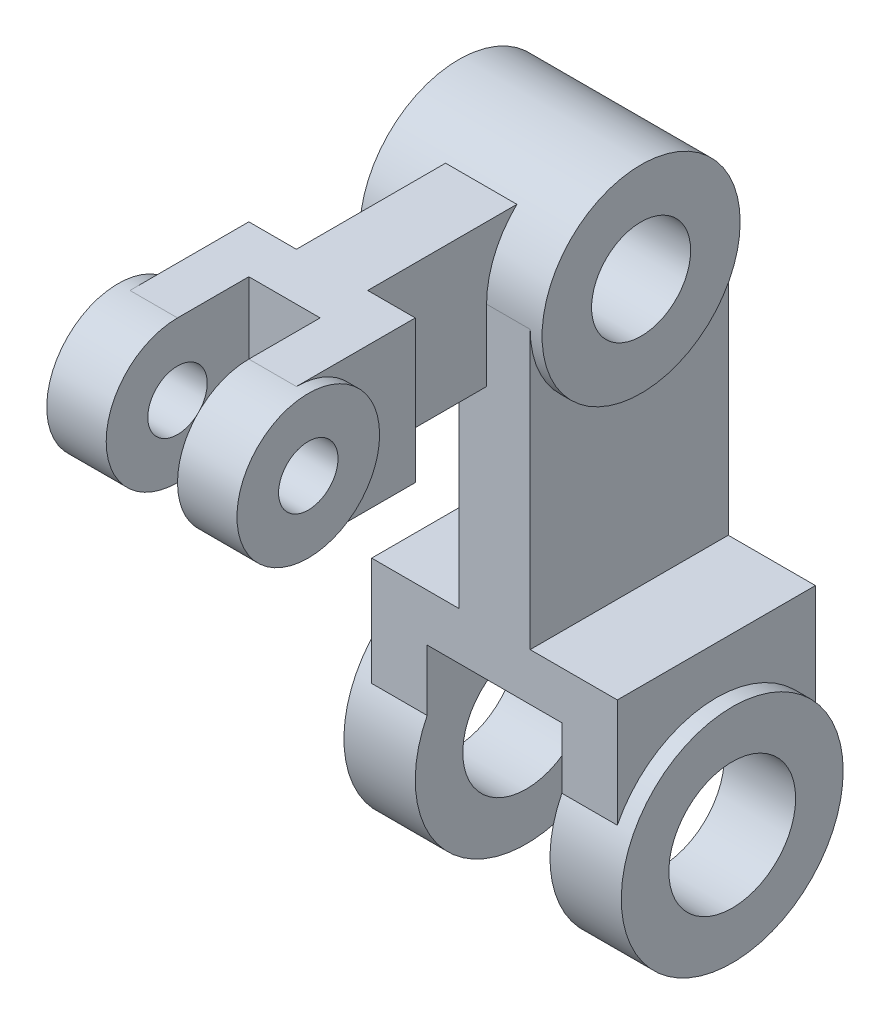
from build123d import *

# Parameters (mm, degrees)
SKETCH1_R               = 25
SKETCH1_R_2             = 12.5
BOSS_EXTRUDE1_DEPTH     = 23
BOSS_EXTRUDE3_START     = 20
BOSS_EXTRUDE3_DEPTH     = 18
SKETCH5_R               = 16
BOSS_EXTRUDE4_DEPTH     = 35
BOSS_EXTRUDE5_DEPTH     = 31
CUT_EXTRUDE2_DEPTH      = 155.819249449
CUT_EXTRUDE2_DEPTH_BACK = 155.819249449
SKETCH6_W               = 34
SKETCH6_H               = 70
SKETCH8_R               = 18
SKETCH8_R_2             = 7.5
BOSS_EXTRUDE6_DEPTH     = 24
BOSS_EXTRUDE7_DEPTH     = 21
BOSS_EXTRUDE8_DEPTH     = 9
CUT_EXTRUDE4_DEPTH      = 193.512337267
CUT_EXTRUDE4_DEPTH_BACK = 193.512337267
SKETCH10_W              = 18
SKETCH10_H              = 50


with BuildPart() as part:
    # Sketch1 → Boss-Extrude1 (new, symmetric)
    with BuildSketch(Plane(origin=(0, 0, 0), x_dir=(0, 0, -1), z_dir=(1, 0, 0))):
        Circle(SKETCH1_R)
        Circle(SKETCH1_R_2, mode=Mode.SUBTRACT)
    extrude(amount=BOSS_EXTRUDE1_DEPTH, both=True)

    # Sketch4 → Boss-Extrude3 (add)
    with BuildSketch(Plane(origin=(0, 0, 0), x_dir=(0, 0, -1), z_dir=(1, 0, 0)).offset(BOSS_EXTRUDE3_START)):
        with BuildLine():
            Line((-25, 0), (-25, -70))
            Line((-25, -70), (25, -70))
            Line((25, -70), (25, 0))
            ThreePointArc((25, 0), (0, -25), (-25, 0))
        make_face()
    extrude(amount=-BOSS_EXTRUDE3_DEPTH)



with BuildPart() as body_2:
    # Sketch5 → Boss-Extrude4 (new, symmetric)
    with BuildSketch(Plane(origin=(11, 0, 0), x_dir=(0, 0, -1), z_dir=(1, 0, 0))):
        with BuildLine():
            ThreePointArc((25, -97.390479787), (0, -82), (-25, -97.390479787))
            ThreePointArc((-25, -97.390479787), (-6.480740698, -137.239676944), (28, -110))
            ThreePointArc((28, -110), (27.239676944, -103.519259302), (25, -97.390479787))
        make_face()
        with Locations((0, -110)):
            Circle(SKETCH5_R, mode=Mode.SUBTRACT)
    extrude(amount=BOSS_EXTRUDE4_DEPTH, both=True)


with BuildPart() as part_1:
    add(part.part)

    add(body_2.part)  # Boss-Extrude5 merges body 2
    # Sketch5<4> → Boss-Extrude5 (add, symmetric)
    with BuildSketch(Plane(origin=(11, 0, 0), x_dir=(0, 0, -1), z_dir=(1, 0, 0))):
        with BuildLine():
            Line((-25, -70), (-25, -97.390479787))
            ThreePointArc((-25, -97.390479787), (0, -82), (25, -97.390479787))
            Line((25, -97.390479787), (25, -70))
            Line((25, -70), (-25, -70))
        make_face()
    extrude(amount=BOSS_EXTRUDE5_DEPTH, both=True)

    # Sketch6 → Cut-Extrude2 (cut, two sides: drawn at the far end of the back side and taken through both)
    with BuildSketch(Plane.XY.offset(25).offset(-CUT_EXTRUDE2_DEPTH_BACK)):
        with Locations((11, -117)):
            Rectangle(SKETCH6_W, SKETCH6_H)
    extrude(amount=CUT_EXTRUDE2_DEPTH + CUT_EXTRUDE2_DEPTH_BACK, mode=Mode.SUBTRACT)



with BuildPart() as body_2_2:
    # Sketch8 → Boss-Extrude6 (new, symmetric)
    with BuildSketch(Plane(origin=(0, 0, 0), x_dir=(0, 0, -1), z_dir=(1, 0, 0))):
        with Locations((-85, 0)):
            Circle(SKETCH8_R)
        with Locations((-85, 0)):
            Circle(SKETCH8_R_2, mode=Mode.SUBTRACT)
    extrude(amount=BOSS_EXTRUDE6_DEPTH, both=True)

    # Sketch9 → Boss-Extrude7 (add, symmetric)
    with BuildSketch(Plane(origin=(0, 0, 0), x_dir=(0, 0, -1), z_dir=(1, 0, 0))):
        with BuildLine():
            Line((-55, 18), (-85, 18))
            ThreePointArc((-85, 18), (-67, 0), (-85, -18))
            Line((-85, -18), (-55, -18))
            Line((-55, -18), (-55, 18))
        make_face()
    extrude(amount=BOSS_EXTRUDE7_DEPTH, both=True)


with BuildPart() as part_2:
    add(part_1.part)

    add(body_2_2.part)  # Boss-Extrude8 merges body 2 2
    # Sketch9<3> → Boss-Extrude8 (add, symmetric)
    with BuildSketch(Plane(origin=(0, 0, 0), x_dir=(0, 0, -1), z_dir=(1, 0, 0))):
        with BuildLine():
            Line((-17.349351573, 18), (-55, 18))
            Line((-55, 18), (-55, -18))
            Line((-55, -18), (-25, -18))
            Line((-25, -18), (-25, 0))
            ThreePointArc((-25, 0), (-23.007974588, 9.779218033), (-17.349351573, 18))
        make_face()
    extrude(amount=BOSS_EXTRUDE8_DEPTH, both=True)

    # Sketch10 → Cut-Extrude4 (cut, two sides: drawn at the far end of the back side and taken through both)
    with BuildSketch(Plane(origin=(0, 18, 0), x_dir=(1, 0, 0), z_dir=(0, 1, 0)).offset(-CUT_EXTRUDE4_DEPTH_BACK)):
        with Locations((0, -92)):
            Rectangle(SKETCH10_W, SKETCH10_H)
    extrude(amount=CUT_EXTRUDE4_DEPTH + CUT_EXTRUDE4_DEPTH_BACK, mode=Mode.SUBTRACT)


solid = part_2.part
